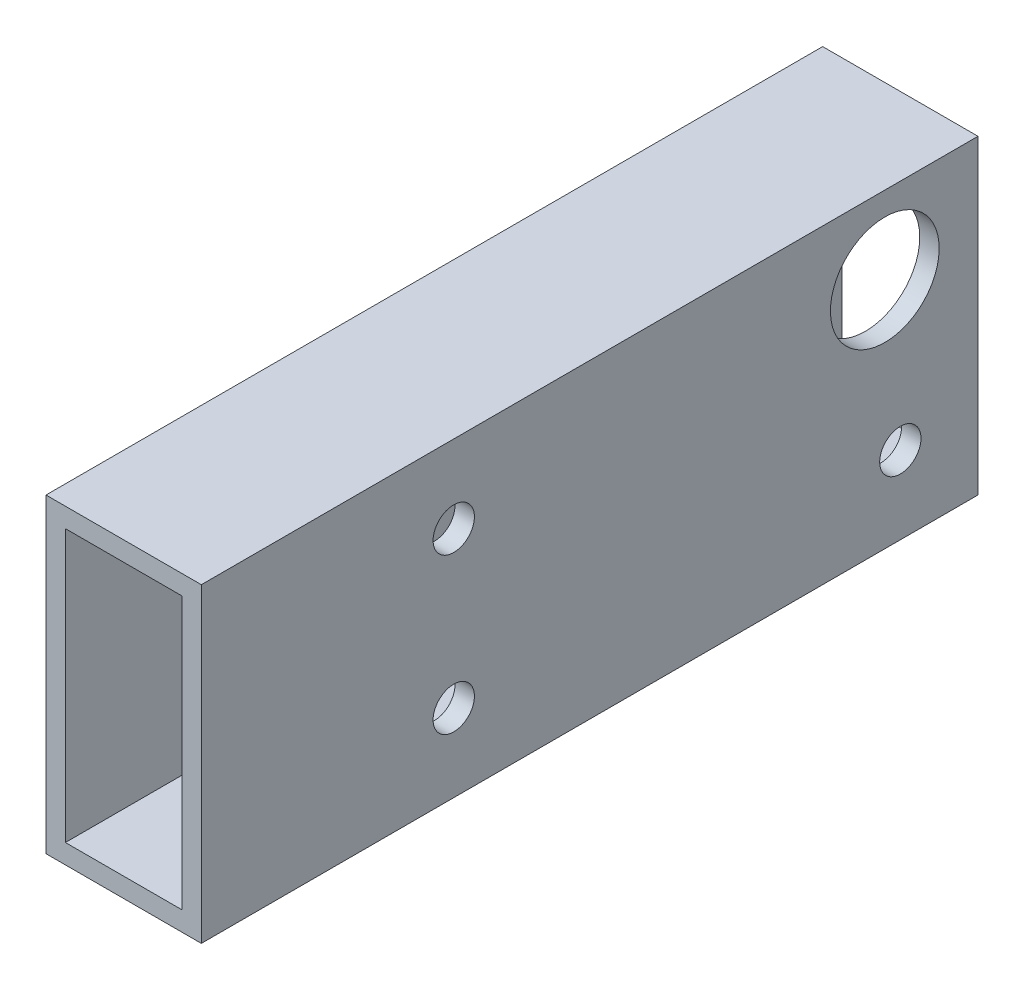
from build123d import *

# Parameters (mm, degrees)
SKETCH1_W           = 25.4
SKETCH1_H           = 50.8
SKETCH1_W_2         = 19.05
SKETCH1_H_2         = 44.45
BOSS_EXTRUDE1_DEPTH = 63.5
SKETCH2_R           = 3.3782
CUT_EXTRUDE3_DEPTH  = 73.955945611
SKETCH3_R           = 8.89
CUT_EXTRUDE4_DEPTH  = 73.955945611


with BuildPart() as part:
    # Sketch1 → Boss-Extrude1 (new, symmetric)
    with BuildSketch(Plane.XY):
        Rectangle(SKETCH1_W, SKETCH1_H)
        Rectangle(SKETCH1_W_2, SKETCH1_H_2, mode=Mode.SUBTRACT)
    extrude(amount=BOSS_EXTRUDE1_DEPTH, both=True)

    # Sketch2 → Cut-Extrude3 (cut, through all)
    with BuildSketch(Plane(origin=(12.7, 0, 0), x_dir=(0, 0, -1), z_dir=(1, 0, 0))):
        with Locations(Location((-22.225, 12.7, 0), (0, 0, 90))):
            Circle(SKETCH2_R)
        with Locations(Location((-22.225, -12.7, 0), (0, 0, 90))):
            Circle(SKETCH2_R)
        with Locations(Location((50.8, -12.7, 0), (0, 0, 90))):
            Circle(SKETCH2_R)
    extrude(amount=-CUT_EXTRUDE3_DEPTH, mode=Mode.SUBTRACT)

    # Sketch3 → Cut-Extrude4 (cut, through all)
    with BuildSketch(Plane(origin=(12.7, 0, 0), x_dir=(0, 0, -1), z_dir=(1, 0, 0))):
        with Locations(Location((48.26, 12.7, 0), (0, 0, 90))):
            Circle(SKETCH3_R)
    extrude(amount=-CUT_EXTRUDE4_DEPTH, mode=Mode.SUBTRACT)


solid = part.part
